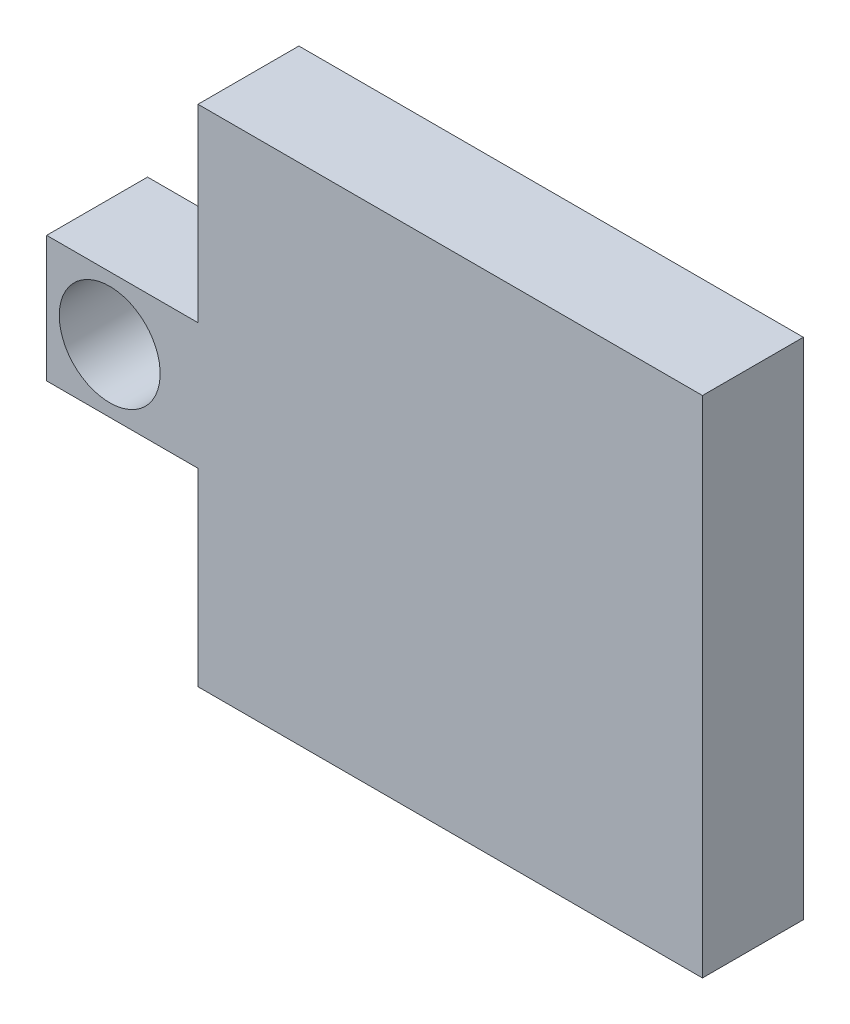
from build123d import *

# Parameters (mm, degrees)
SKETCH1_W           = 50
SKETCH1_H           = 50
BOSS_EXTRUDE1_DEPTH = 10
SKETCH6_W           = 10
SKETCH6_H           = 12.5
BOSS_EXTRUDE5_DEPTH = 15
SKETCH7_R           = 5
CUT_EXTRUDE2_DEPTH  = 49.218253805


with BuildPart() as part:
    # Sketch1 → Boss-Extrude1 (new body)
    with BuildSketch(Plane.XY):
        Rectangle(SKETCH1_W, SKETCH1_H)
    extrude(amount=BOSS_EXTRUDE1_DEPTH)

    # Sketch6 → Boss-Extrude5 (add)
    with BuildSketch(Plane.ZY.offset(25)):
        with Locations((5, 0)):
            Rectangle(SKETCH6_W, SKETCH6_H)
    extrude(amount=BOSS_EXTRUDE5_DEPTH)

    # Sketch7 → Cut-Extrude2 (cut, through all)
    with BuildSketch(Plane(origin=(0, 0, 0), x_dir=(-1, 0, 0), z_dir=(0, 0, -1))):
        with Locations((33.75, 0)):
            Circle(SKETCH7_R)
    extrude(amount=-CUT_EXTRUDE2_DEPTH, mode=Mode.SUBTRACT)


solid = part.part
